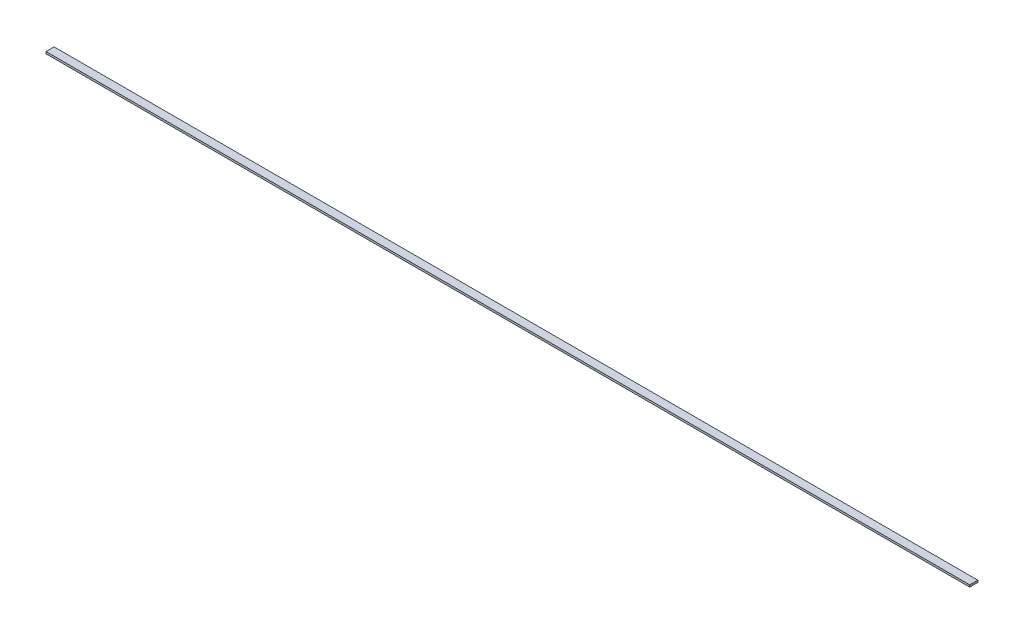
from build123d import *

# Parameters (mm, degrees)
SCHIZZO1_R                  = 8
SCHIZZO1_W                  = 15
SCHIZZO1_H                  = 10
CORPOCENTINA_DEPTH          = 5
RIMOZIONERETROCENTINA_DEPTH = 251.615874848
SCHIZZO3_W                  = 28.2
SCHIZZO3_H                  = 22
TAGLIOLISTELLO_DEPTH        = 14.677233346
ESTRUSIONELISTELLO_DEPTH    = 910


with BuildPart() as part:
    # Schizzo1 → CorpoCentina (new body)
    with BuildSketch(Plane(origin=(0, 0, 0), x_dir=(0, 0, -1), z_dir=(1, 0, 0))):
        with BuildLine():
            add(Edge.make_bspline(
                [(-250, 0), (-250.000228294, -0.008042796), (-248.284955516, 0.172375658), (-246.518112419, 0.308690015), (-242.189387343, 0.685693594), (-236.806461263, 1.074101529), (-229.680385952, 1.49731724), (-221.184158698, 1.823218603), (-211.337618208, 1.967626101), (-200.371188527, 1.833221056), (-188.499913622, 1.38960529), (-175.953687417, 0.706014078), (-162.931424918, -0.160208642), (-149.615771744, -1.148016327), (-136.176354995, -2.19092491), (-122.767140548, -3.219583979), (-109.520053587, -4.152743127), (-96.546095975, -4.938564365), (-83.940819302, -5.536830703), (-71.801839291, -5.947648205), (-60.245256003, -6.218450939), (-49.398732891, -6.355369756), (-39.397226194, -6.381387963), (-30.361934842, -6.26504923), (-22.412181103, -6.012164917), (-15.626227231, -5.597433901), (-10.071907511, -4.928706579), (-5.697692612, -4.040446981), (-2.625320639, -2.865752984), (-0.494884225, -1.71152847), (0.021312549, -0.410454231), (-0.0311692, 0.792659827), (-0.812599242, 2.305684337), (-2.728863517, 4.238352424), (-5.769907241, 6.118172121), (-9.880942804, 7.913594202), (-15.074930468, 9.641318178), (-21.298752222, 11.283896488), (-28.49717212, 12.788381759), (-36.607373406, 14.097834908), (-45.57302844, 15.159429017), (-55.332910074, 15.960903998), (-65.816536498, 16.494069738), (-76.93137626, 16.791989705), (-88.566949028, 16.864754131), (-100.596999886, 16.726715291), (-112.888825982, 16.383385064), (-125.311615819, 15.825573667), (-137.743791097, 15.05233187), (-150.072384382, 14.059339074), (-162.191375056, 12.881586986), (-173.989074322, 11.549280346), (-185.352364446, 10.116249729), (-196.163081698, 8.632379125), (-206.300441402, 7.131513884), (-215.560350587, 5.731221768), (-223.977157043, 4.293295127), (-231.363413336, 3.181808874), (-237.746440904, 2.098942417), (-242.622069366, 1.245861917), (-246.644529332, 0.552864946), (-248.32839844, 0.246216765), (-249.999773563, 0.007977377), (-250, 0)],
                knots=[0, 0, 0, 0, 0.001588889, 0.006329218, 0.014202456, 0.025172808, 0.039173483, 0.056060631, 0.075578924, 0.097363607, 0.120926258, 0.145825281, 0.171670912, 0.198108537, 0.224790184, 0.25139058, 0.277643491, 0.30332675, 0.328257458, 0.352272548, 0.375156062, 0.396620664, 0.416422729, 0.43430442, 0.45005468, 0.463465465, 0.474478994, 0.483169222, 0.489678354, 0.494104066, 0.496910015, 0.497289785, 0.501214273, 0.50645795, 0.513356957, 0.522168632, 0.53296597, 0.545689209, 0.560220779, 0.576438923, 0.594258689, 0.613600245, 0.634342386, 0.656331109, 0.679351894, 0.703152303, 0.727478208, 0.752070739, 0.776691164, 0.801140184, 0.825214387, 0.848697424, 0.871352858, 0.892947449, 0.913230871, 0.931955467, 0.948342069, 0.963693004, 0.976235918, 0.986320059, 0.993788799, 0.998424035, 1, 1, 1, 1], degree=3))
        make_face()
        with Locations((-62.499919709, 5.077322704)):
            Circle(SCHIZZO1_R, mode=Mode.SUBTRACT)
        with Locations((-85.999919709, 5.077322704)):
            Rectangle(SCHIZZO1_W, SCHIZZO1_H, mode=Mode.SUBTRACT)
    extrude(amount=CORPOCENTINA_DEPTH)

    # Schizzo2 → RimozioneRetroCentina (cut, through all)
    with BuildSketch(Plane.ZY):
        with BuildLine():
            Line((10, 7.878242661), (10, -4.848721342))
            add(Edge.make_bspline(
                [(10, -4.848721342), (11.738439481, -5.129194219), (15.73141108, -5.603862327), (22.412181103, -6.012164917), (30.361934842, -6.26504923), (39.397226194, -6.381387963), (49.398732891, -6.355369756), (60.245256003, -6.218450939), (71.801839291, -5.947648205), (83.940819302, -5.536830703), (96.546095975, -4.938564365), (109.520053587, -4.152743127), (122.767140548, -3.219583979), (136.176354995, -2.19092491), (149.615771744, -1.148016327), (162.931424918, -0.160208642), (175.953687417, 0.706014078), (188.499913622, 1.38960529), (200.371188527, 1.833221056), (211.337618208, 1.967626101), (221.184158698, 1.823218603), (229.680385952, 1.49731724), (236.806461263, 1.074101529), (242.189387343, 0.685693594), (246.518112419, 0.308690015), (248.284955516, 0.172375658), (250.427328458, -0.052966701), (248.32839844, 0.246216765), (246.644529332, 0.552864946), (242.622069366, 1.245861917), (237.746440904, 2.098942417), (231.363413336, 3.181808874), (223.977157043, 4.293295127), (215.560350587, 5.731221768), (206.300441402, 7.131513884), (196.163081698, 8.632379125), (185.352364446, 10.116249729), (173.989074322, 11.549280346), (162.191375056, 12.881586986), (150.072384382, 14.059339074), (137.743791097, 15.05233187), (125.311615819, 15.825573667), (112.888825982, 16.383385064), (100.596999886, 16.726715291), (88.566949028, 16.864754131), (76.93137626, 16.791989705), (65.816536498, 16.494069738), (55.332910074, 15.960903998), (45.57302844, 15.159429017), (36.607373406, 14.097834908), (28.49717212, 12.788381759), (21.298752222, 11.283896488), (15.214838321, 9.678242373), (11.571404485, 8.475558385), (10, 7.878242661)],
                knots=[0.526143721, 0.526143721, 0.526143721, 0.526143721, 0.536534535, 0.54994532, 0.56569558, 0.583577271, 0.603379336, 0.624843938, 0.647727452, 0.671742542, 0.69667325, 0.722356509, 0.74860942, 0.775209816, 0.801891463, 0.828329088, 0.854174719, 0.879073742, 0.902636393, 0.924421076, 0.943939369, 0.960826517, 0.974827192, 0.985797544, 0.993670782, 0.998411111, 1, 1.001575965, 1.006211201, 1.013679941, 1.023764082, 1.036306996, 1.051657931, 1.068044533, 1.086769129, 1.107052551, 1.128647142, 1.151302576, 1.174785613, 1.198859816, 1.223308836, 1.247929261, 1.272521792, 1.296847697, 1.320648106, 1.343668891, 1.365657614, 1.386399755, 1.405741311, 1.423561077, 1.439779221, 1.454310791, 1.46703403, 1.476975978, 1.476975978, 1.476975978, 1.476975978], degree=3))
        make_face()
    extrude(amount=-RIMOZIONERETROCENTINA_DEPTH, mode=Mode.SUBTRACT)

    # Schizzo3 → TaglioListello (cut, through all)
    with BuildSketch(Plane(origin=(5, 0, 0), x_dir=(0, 0, -1), z_dir=(1, 0, 0))):
        with Locations((-4.099919705, -1.2163e-05)):
            Rectangle(SCHIZZO3_W, SCHIZZO3_H)
        with BuildLine():
            Line((-8.199919705, 0.999987837), (-8.199919705, -1.000012163))
            Line((-8.199919705, -1.000012163), (-0.266541428, -1.000012163))
            add(Edge.make_bspline(
                [(-0.266541428, -1.000012163), (-0.103493894, -0.689338227), (0.015569485, -0.278797762), (-0.014332603, 0.406690484), (-0.10008233, 0.738824912), (-0.201511969, 0.999987837)],
                knots=[0.494882134, 0.494882134, 0.494882134, 0.494882134, 0.496910015, 0.497289785, 0.498933258, 0.498933258, 0.498933258, 0.498933258], degree=3))
            Line((-0.201511969, 0.999987837), (-8.199919705, 0.999987837))
        make_face(mode=Mode.SUBTRACT)
    extrude(amount=-TAGLIOLISTELLO_DEPTH, mode=Mode.SUBTRACT)

    # Schizzo4 → EstrusioneListello (add)
    with BuildSketch(Plane(origin=(5, 0, 0), x_dir=(0, 0, -1), z_dir=(1, 0, 0))):
        with BuildLine():
            Line((-8.199919705, -1.000012163), (-0.266541428, -1.000012163))
            add(Edge.make_bspline(
                [(-0.266541428, -1.000012163), (-0.103493894, -0.689338227), (0.015569485, -0.278797762), (-0.014332603, 0.406690484), (-0.10008233, 0.738824912), (-0.201511969, 0.999987837)],
                knots=[0.494882134, 0.494882134, 0.494882134, 0.494882134, 0.496910015, 0.497289785, 0.498933258, 0.498933258, 0.498933258, 0.498933258], degree=3))
            Line((-0.201511969, 0.999987837), (-8.199919705, 0.999987837))
            Line((-8.199919705, 0.999987837), (-8.199919705, -1.000012163))
        make_face()
    extrude(amount=ESTRUSIONELISTELLO_DEPTH)


solid = part.part
